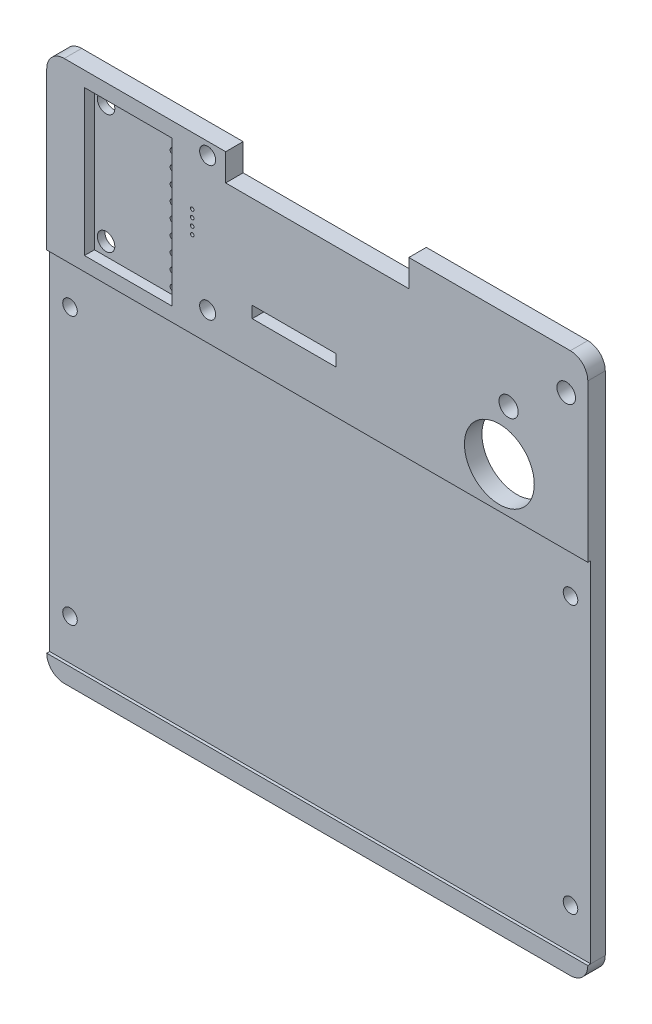
from build123d import *

# Parameters (mm, degrees)
SKETCH1_W           = 92.97433
SKETCH1_H           = 93
BOSS_EXTRUDE1_DEPTH = 3
FILLET1_R           = 3
SKETCH4_R           = 1.6
SKETCH4_R_2         = 1.65
CUT_EXTRUDE3_DEPTH  = 3
SKETCH2_W           = 14.4
SKETCH2_H           = 2
SKETCH2_W_2         = 31.48
SKETCH2_H_2         = 4.65
SKETCH2_R           = 1.375
SKETCH2_R_2         = 0.3
CUT_EXTRUDE5_DEPTH  = 10
SKETCH2_5_R         = 0.3
CUT_EXTRUDE6_DEPTH  = 10
SKETCH2_6_R         = 1.25
CUT_EXTRUDE7_DEPTH  = 66.820259113
SKETCH2_7_R         = 1.25
CUT_EXTRUDE8_DEPTH  = 0.5
SKETCH6_R           = 6
CUT_EXTRUDE9_DEPTH  = 66.820259113
SKETCH7_R           = 1.5
SKETCH7_R_2         = 0.5
CUT_EXTRUDE10_DEPTH = 5
SKETCH7_3_W         = 15
SKETCH7_3_H         = 25
SKETCH7_3_R         = 1.5
SKETCH7_3_R_2       = 0.5
CUT_EXTRUDE11_DEPTH = 1.71


with BuildPart() as part:
    # Sketch1 → Boss-Extrude1 (new body)
    with BuildSketch(Plane.XY):
        Rectangle(SKETCH1_W, SKETCH1_H)
    extrude(amount=BOSS_EXTRUDE1_DEPTH)

    # Fillet1
    fillet1_edges = [part.edges().sort_by_distance(p)[0] for p in [
        (-46.487165, -46.5, 1.5),
        (46.487165, -46.5, 1.5),
        (46.487165, 46.5, 1.5),
        (-46.487165, 46.5, 1.5),
    ]]
    fillet(fillet1_edges, radius=FILLET1_R)

    # Sketch4 → Cut-Extrude3 (cut)
    with BuildSketch(Plane.XY.offset(3)):
        with Locations((42.777165, 39.9)):
            Circle(SKETCH4_R)
        with Locations((32.877165, 32.89)):
            Circle(SKETCH4_R_2)
    extrude(amount=-CUT_EXTRUDE3_DEPTH, mode=Mode.SUBTRACT)

    # Sketch2 → Cut-Extrude5 (cut)
    with BuildSketch(Plane.XY.offset(3)):
        with Locations((-3.98, 24.93)):
            Rectangle(SKETCH2_W, SKETCH2_H)
        with Locations((0, 44.175)):
            Rectangle(SKETCH2_W_2, SKETCH2_H_2)
        with Locations((-18.84, 21.39)):
            Circle(SKETCH2_R)
        with Locations((-21.49, 35.08)):
            Circle(SKETCH2_R_2)
        with Locations((-18.84, 44.39)):
            Circle(SKETCH2_R)
    extrude(amount=-CUT_EXTRUDE5_DEPTH, mode=Mode.SUBTRACT)

    # Sketch2<5> → Cut-Extrude6 (cut)
    with BuildSketch(Plane.XY.offset(3)):
        with Locations((-21.49, 33.81)):
            Circle(SKETCH2_5_R)
        with Locations((-21.49, 32.54)):
            Circle(SKETCH2_5_R)
        with Locations((-21.49, 31.27)):
            Circle(SKETCH2_5_R)
    extrude(amount=-CUT_EXTRUDE6_DEPTH, mode=Mode.SUBTRACT)

    # Sketch2<6> → Cut-Extrude7 (cut, through all)
    with BuildSketch(Plane.XY.offset(3)):
        with Locations((-42.988663401, 9.5)):
            Circle(SKETCH2_6_R)
        with Locations((43.014333401, 9.5)):
            Circle(SKETCH2_6_R)
        with Locations((43.014333401, -36.5)):
            Circle(SKETCH2_6_R)
        with Locations((-42.988663401, -36.5)):
            Circle(SKETCH2_6_R)
    extrude(amount=-CUT_EXTRUDE7_DEPTH, mode=Mode.SUBTRACT)

    # Sketch2<7> → Cut-Extrude8 (cut)
    with BuildSketch(Plane.XY.offset(3)):
        Polygon((-46.487165, -13.5), (-46.487165, -43.5), (46.487165, -43.5), (46.487165, 16.5), (-46.487165, 16.5), align=None)
        with Locations((-42.988663401, -36.5)):
            Circle(SKETCH2_7_R, mode=Mode.SUBTRACT)
        with Locations((-42.988663401, 9.5)):
            Circle(SKETCH2_7_R, mode=Mode.SUBTRACT)
        with Locations((43.014333401, 9.5)):
            Circle(SKETCH2_7_R, mode=Mode.SUBTRACT)
        with Locations((43.014333401, -36.5)):
            Circle(SKETCH2_7_R, mode=Mode.SUBTRACT)
    extrude(amount=-CUT_EXTRUDE8_DEPTH, mode=Mode.SUBTRACT)

    # Sketch6 → Cut-Extrude9 (cut, through all)
    with BuildSketch(Plane.XY.offset(3)):
        with Locations((31.287165, 23.5)):
            Circle(SKETCH6_R)
    extrude(amount=-CUT_EXTRUDE9_DEPTH, mode=Mode.SUBTRACT)

    # Sketch7 → Cut-Extrude10 (cut)
    with BuildSketch(Plane.XY.offset(3)):
        with Locations((-38.00049081, 21.162365948)):
            Circle(SKETCH7_R)
        with Locations((-38.00049081, 41.662365948)):
            Circle(SKETCH7_R)
        with Locations((-26.50049081, 42.842365948)):
            Circle(SKETCH7_R_2)
        with Locations((-26.50049081, 40.302365948)):
            Circle(SKETCH7_R_2)
        with Locations((-26.50049081, 37.762365948)):
            Circle(SKETCH7_R_2)
        with Locations((-26.50049081, 35.222365948)):
            Circle(SKETCH7_R_2)
        with Locations((-26.50049081, 32.682365948)):
            Circle(SKETCH7_R_2)
        with Locations((-26.50049081, 30.142365948)):
            Circle(SKETCH7_R_2)
        with Locations((-26.50049081, 27.602365948)):
            Circle(SKETCH7_R_2)
        with Locations((-26.50049081, 25.062365948)):
            Circle(SKETCH7_R_2)
        with Locations((-26.50049081, 22.522365948)):
            Circle(SKETCH7_R_2)
        with Locations((-26.50049081, 19.982365948)):
            Circle(SKETCH7_R_2)
    extrude(amount=-CUT_EXTRUDE10_DEPTH, mode=Mode.SUBTRACT)

    # Sketch7<3> → Cut-Extrude11 (cut)
    with BuildSketch(Plane.XY.offset(3)):
        with Locations((-32.50049081, 31.412365948)):
            Rectangle(SKETCH7_3_W, SKETCH7_3_H)
        with Locations((-38.00049081, 21.162365948)):
            Circle(SKETCH7_3_R, mode=Mode.SUBTRACT)
        with Locations((-38.00049081, 41.662365948)):
            Circle(SKETCH7_3_R, mode=Mode.SUBTRACT)
        with Locations((-26.50049081, 42.842365948)):
            Circle(SKETCH7_3_R_2, mode=Mode.SUBTRACT)
        with Locations((-26.50049081, 40.302365948)):
            Circle(SKETCH7_3_R_2, mode=Mode.SUBTRACT)
        with Locations((-26.50049081, 37.762365948)):
            Circle(SKETCH7_3_R_2, mode=Mode.SUBTRACT)
        with Locations((-26.50049081, 35.222365948)):
            Circle(SKETCH7_3_R_2, mode=Mode.SUBTRACT)
        with Locations((-26.50049081, 32.682365948)):
            Circle(SKETCH7_3_R_2, mode=Mode.SUBTRACT)
        with Locations((-26.50049081, 30.142365948)):
            Circle(SKETCH7_3_R_2, mode=Mode.SUBTRACT)
        with Locations((-26.50049081, 27.602365948)):
            Circle(SKETCH7_3_R_2, mode=Mode.SUBTRACT)
        with Locations((-26.50049081, 25.062365948)):
            Circle(SKETCH7_3_R_2, mode=Mode.SUBTRACT)
        with Locations((-26.50049081, 22.522365948)):
            Circle(SKETCH7_3_R_2, mode=Mode.SUBTRACT)
        with Locations((-26.50049081, 19.982365948)):
            Circle(SKETCH7_3_R_2, mode=Mode.SUBTRACT)
    extrude(amount=-CUT_EXTRUDE11_DEPTH, mode=Mode.SUBTRACT)


solid = part.part
